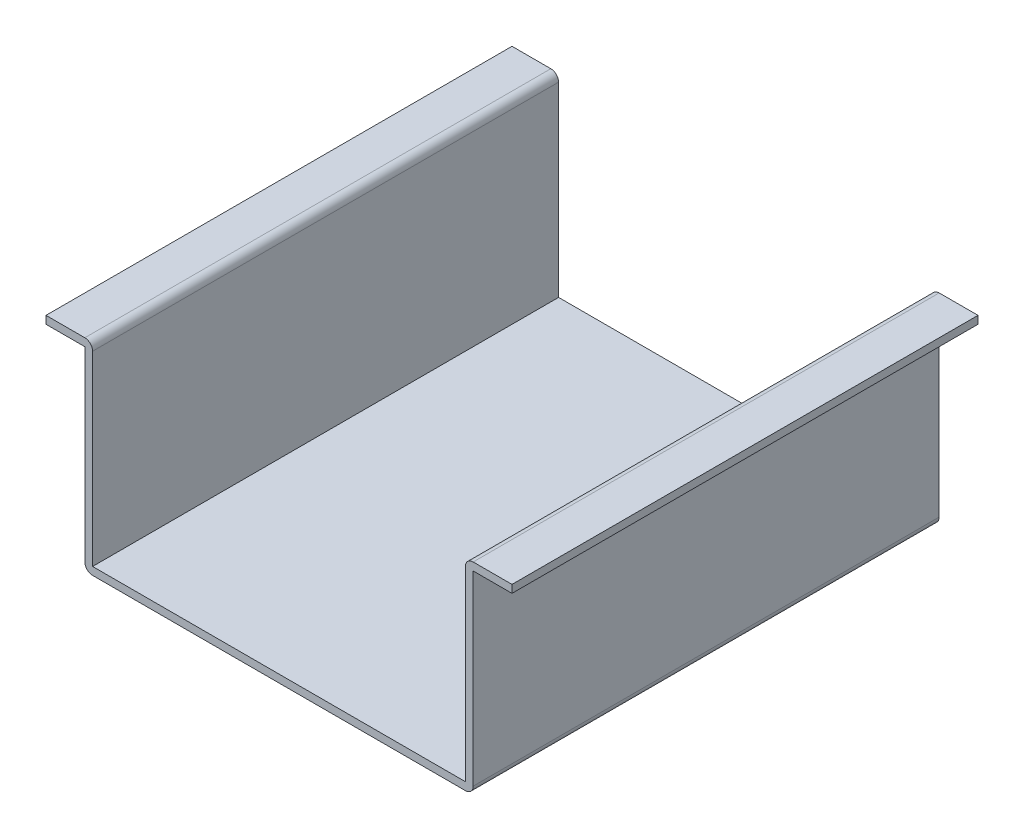
from build123d import *

# Parameters (mm, degrees)
SKETCH_1_W          = 120
SKETCH_1_H          = 120
EXTRUDE_1_DEPTH     = 52
SKETCH_2_W          = 96
SKETCH_2_H          = 50
CUT_EXTRUDE_1_DEPTH = 144.888845989
SKETCH_4_W          = 10
SKETCH_4_H          = 50
CUT_EXTRUDE_2_DEPTH = 144.888845989
SKETCH_5_W          = 10
SKETCH_5_H          = 50
CUT_EXTRUDE_3_DEPTH = 144.888845989
FILLET_1_R          = 2


with BuildPart() as part:
    # 草图1 → 凸台-拉伸1 (new body)
    with BuildSketch(Plane(origin=(0, 52, 0), x_dir=(1, 0, 0), z_dir=(0, 1, 0))):
        Rectangle(SKETCH_1_W, SKETCH_1_H)
    extrude(amount=-EXTRUDE_1_DEPTH)

    # 草图2 → 切除-拉伸1 (cut, through all)
    with BuildSketch(Plane(origin=(0, 0, -60), x_dir=(-1, 0, 0), z_dir=(0, 0, -1))):
        with Locations((0, 27)):
            Rectangle(SKETCH_2_W, SKETCH_2_H)
    extrude(amount=-CUT_EXTRUDE_1_DEPTH, mode=Mode.SUBTRACT)

    # 草图4 → 切除-拉伸2 (cut, through all)
    with BuildSketch(Plane.XY.offset(60)):
        with Locations((55, 25)):
            Rectangle(SKETCH_4_W, SKETCH_4_H)
    extrude(amount=-CUT_EXTRUDE_2_DEPTH, mode=Mode.SUBTRACT)

    # 草图5 → 切除-拉伸3 (cut, through all)
    with BuildSketch(Plane(origin=(0, 0, -60), x_dir=(-1, 0, 0), z_dir=(0, 0, -1))):
        with Locations((55, 25)):
            Rectangle(SKETCH_5_W, SKETCH_5_H)
    extrude(amount=-CUT_EXTRUDE_3_DEPTH, mode=Mode.SUBTRACT)

    # 圆角1
    fillet_1_edges = [part.edges().sort_by_distance(p)[0] for p in [
        (48, 52, 0),
        (-48, 52, 0),
        (50, 0, 0),
        (-50, 0, 0),
    ]]
    fillet(fillet_1_edges, radius=FILLET_1_R)


solid = part.part
